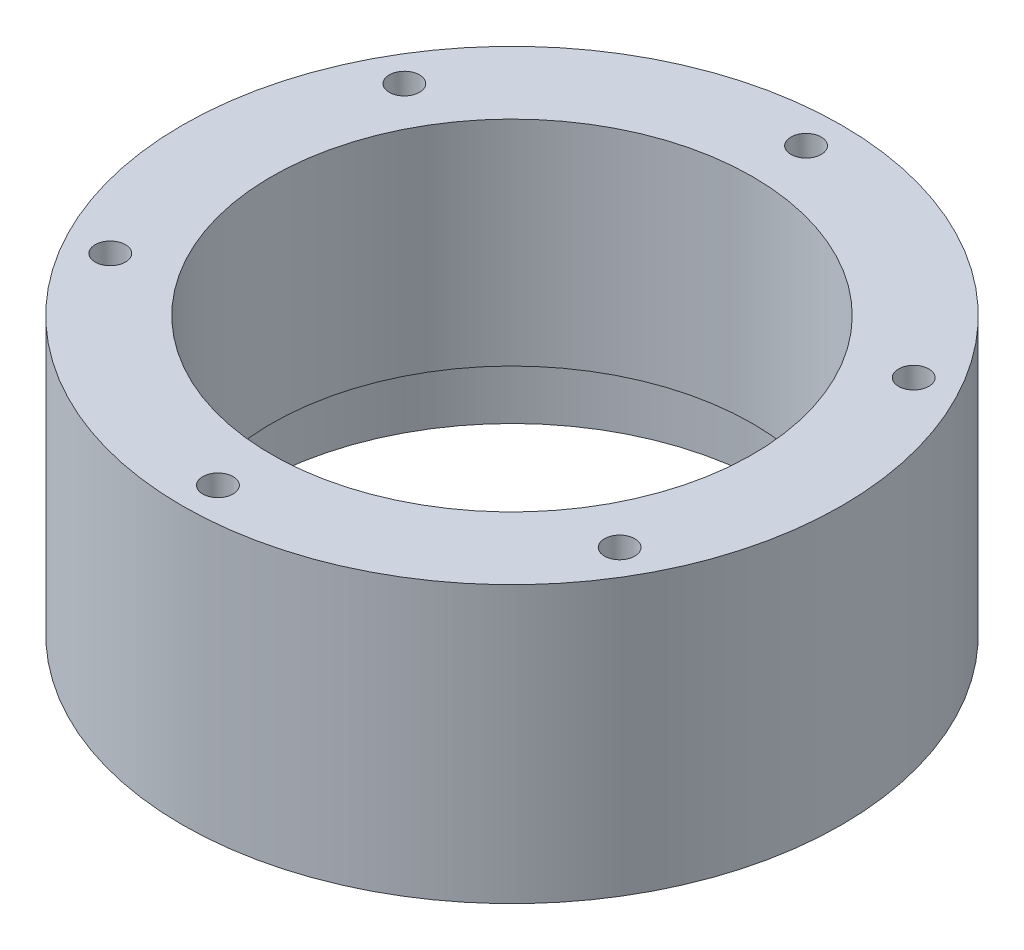
from build123d import *

# Parameters (mm, degrees)
CBORE_FOR_M3_HEX_SOCKET_HEAD_CAP_SCREW1_D           = 3.4
CBORE_FOR_M3_HEX_SOCKET_HEAD_CAP_SCREW1_CBORE_D     = 6.5
CBORE_FOR_M3_HEX_SOCKET_HEAD_CAP_SCREW1_CBORE_DEPTH = 3.4


with BuildPart() as part:
    # Sketch1 → Revolve1 (revolve)
    with BuildSketch(Plane.XY, mode=Mode.PRIVATE) as revolve1_sk:
        Polygon((29, 0), (37, 0), (37, 31), (27, 31), (27, 7), (29, 7), align=None)
    revolve(revolve1_sk.sketch.rotate(Axis((0, 0, 0), (0, 1, 0)), 90), axis=Axis((0, 0, 0), (0, 1, 0)))

    # CBORE for M3 Hex Socket Head Cap Screw1 (through all)
    with Locations(Plane(origin=(0, 0, 0), x_dir=(-1, 0, 0), z_dir=(0, -1, 0))):
        with Locations((28.578838325, -16.5), (0, -33), (-28.578838325, -16.5), (-28.578838325, 16.5), (0, 33), (28.578838325, 16.5)):
            CounterBoreHole(CBORE_FOR_M3_HEX_SOCKET_HEAD_CAP_SCREW1_D / 2, CBORE_FOR_M3_HEX_SOCKET_HEAD_CAP_SCREW1_CBORE_D / 2, CBORE_FOR_M3_HEX_SOCKET_HEAD_CAP_SCREW1_CBORE_DEPTH)


solid = part.part
